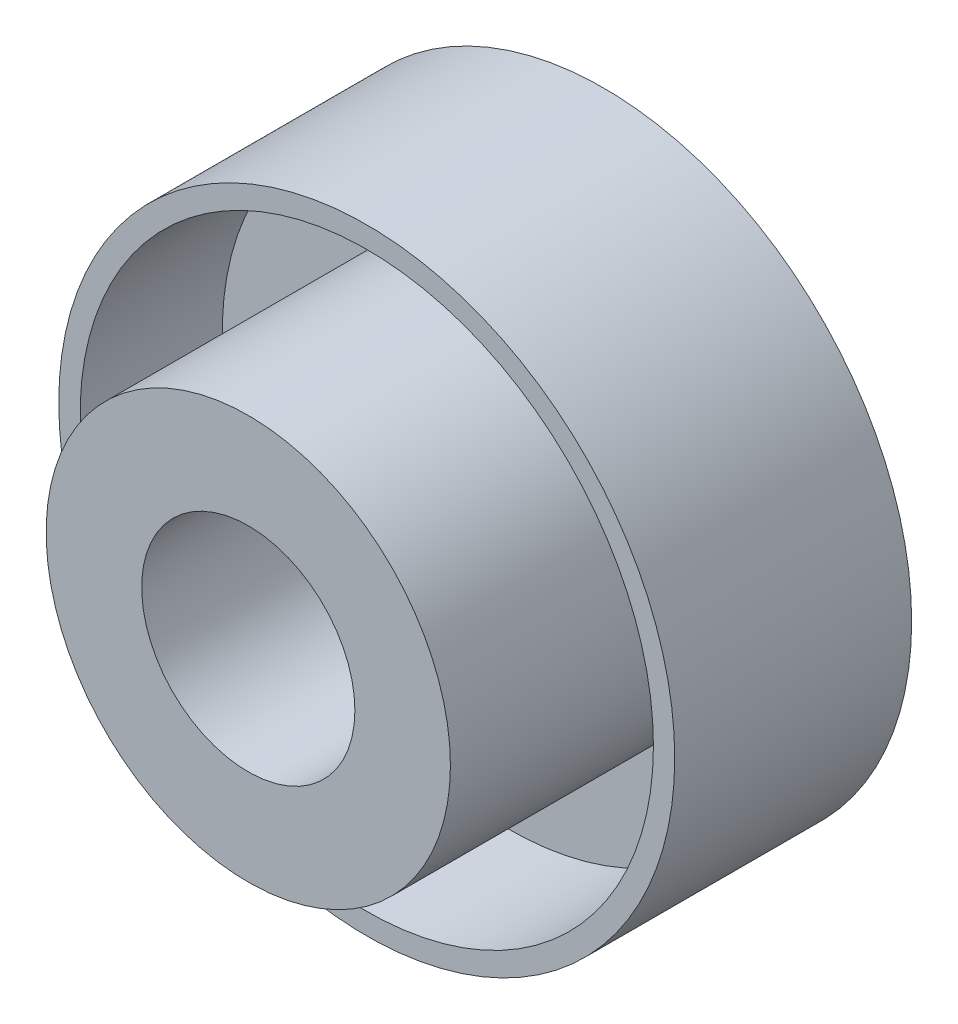
from build123d import *

# Parameters (mm, degrees)
SKETCH_1_R      = 12.1
SKETCH_1_R_2    = 8.531837724
EXTRUDE_1_DEPTH = 4
SKETCH_1_4_R    = 13
SKETCH_1_4_R_2  = 12.1
EXTRUDE_2_DEPTH = 10
SKETCH_1_5_R    = 8.531837724
SKETCH_1_5_R_2  = 4.5
EXTRUDE_3_DEPTH = 15


with BuildPart() as part:
    # Эскиз1 → Бобышка-Вытянуть1 (new body)
    with BuildSketch(Plane.XY):
        Circle(SKETCH_1_R)
        Circle(SKETCH_1_R_2, mode=Mode.SUBTRACT)
    extrude(amount=EXTRUDE_1_DEPTH)

    # Эскиз1<4> → Бобышка-Вытянуть2 (add)
    with BuildSketch(Plane.XY):
        Circle(SKETCH_1_4_R)
        Circle(SKETCH_1_4_R_2, mode=Mode.SUBTRACT)
    extrude(amount=EXTRUDE_2_DEPTH)

    # Эскиз1<5> → Бобышка-Вытянуть3 (add)
    with BuildSketch(Plane.XY):
        Circle(SKETCH_1_5_R)
        Circle(SKETCH_1_5_R_2, mode=Mode.SUBTRACT)
    extrude(amount=EXTRUDE_3_DEPTH)


solid = part.part
